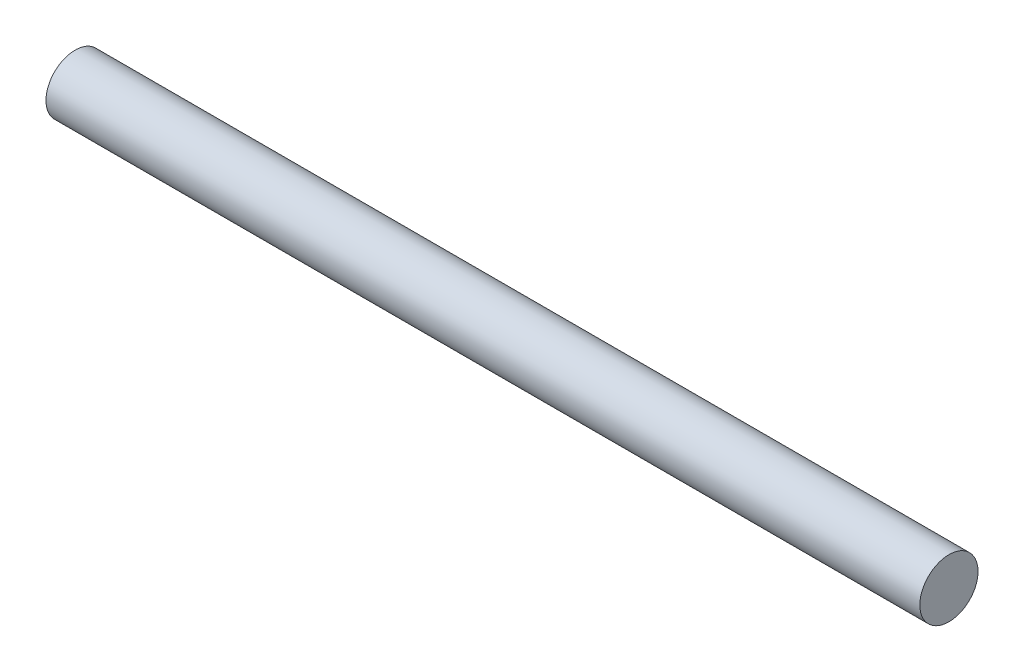
from build123d import *

# Parameters (mm, degrees)
SKETCH1_W = 180.17
SKETCH1_H = 6


with BuildPart() as part:
    # Sketch1 → Revolve1 (revolve)
    with BuildSketch(Plane(origin=(0, 0, 0), x_dir=(1, 0, 0), z_dir=(0, 1, 0)), mode=Mode.PRIVATE) as revolve1_sk:
        with Locations((55.364538905, 9)):
            Rectangle(SKETCH1_W, SKETCH1_H)
    revolve(revolve1_sk.sketch.rotate(Axis((-34.720461095, 0, -6), (1, 0, 0)), 180), axis=Axis((-34.720461095, 0, -6), (1, 0, 0)))


solid = part.part
